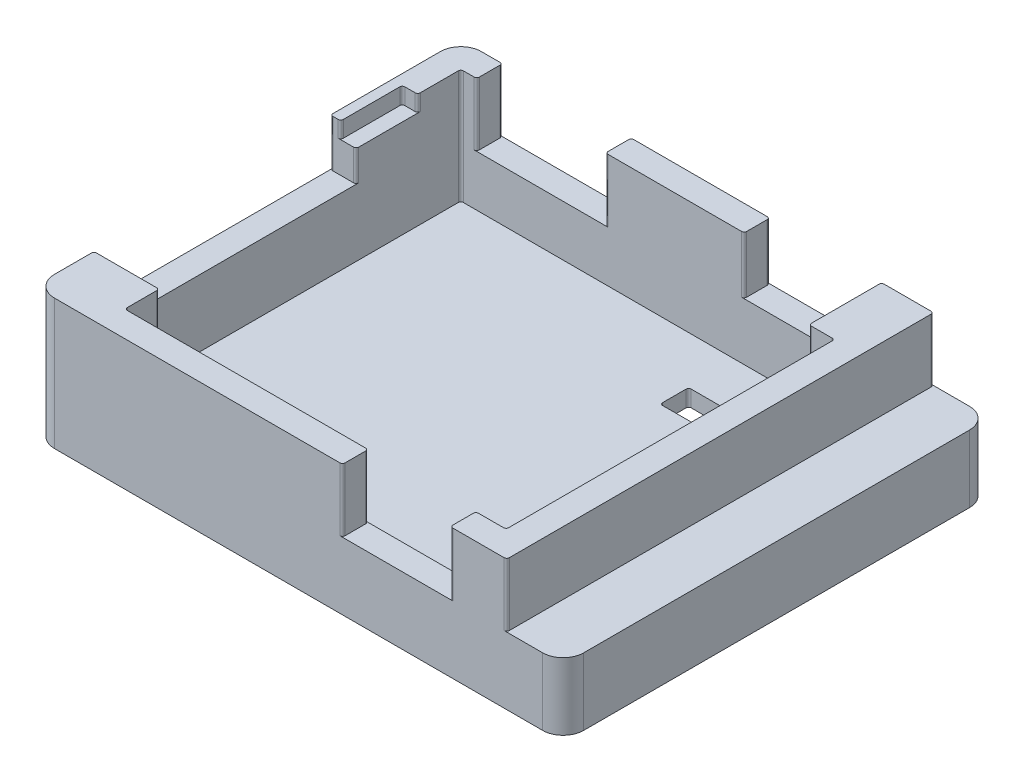
from build123d import *

# Parameters (mm, degrees)
SKETCH1_W           = 103.124
SKETCH1_H           = 83.185
BOSS_EXTRUDE1_DEPTH = 25.4
CUT_EXTRUDE1_DEPTH  = 22.225
SKETCH3_W           = 11
SKETCH3_H           = 83.185
CUT_EXTRUDE2_DEPTH  = 12.3
CUT_EXTRUDE3_REACH  = 136.905
SKETCH4_W           = 21.8
SKETCH4_H           = 11.1
SKETCH4_W_2         = 25.1
SKETCH4_H_2         = 12.3
SKETCH6_W           = 46.085
SKETCH6_H           = 9.2
CUT_EXTRUDE5_DEPTH  = 5.08
SKETCH7_W           = 3
SKETCH7_H           = 12
CUT_EXTRUDE6_DEPTH  = 3.175
SKETCH8_W           = 11.1125
SKETCH8_H           = 5.55625
CUT_EXTRUDE7_DEPTH  = 5.08
FILLET1_R           = 4
CUT_EXTRUDE8_REACH  = 136.905
SKETCH9_W           = 21
SKETCH9_H           = 12.3
FILLET2_R           = 0.5


with BuildPart() as part:
    # Sketch1 → Boss-Extrude1 (new body)
    with BuildSketch(Plane(origin=(0, 0, 0), x_dir=(1, 0, 0), z_dir=(0, 1, 0))):
        with Locations((51.562, 41.5925)):
            Rectangle(SKETCH1_W, SKETCH1_H)
    extrude(amount=BOSS_EXTRUDE1_DEPTH)

    # Sketch2 → Cut-Extrude1 (cut)
    with BuildSketch(Plane(origin=(0, 25.4, 0), x_dir=(1, 0, 0), z_dir=(0, 1, 0))):
        Polygon((5, 78.185), (82, 78.185), (82, 69.0118), (87, 69.0118), (87, 5), (12.7, 5), (12.7, 11.7), (5, 11.7), align=None)
    extrude(amount=-CUT_EXTRUDE1_DEPTH, mode=Mode.SUBTRACT)

    # Sketch3 → Cut-Extrude2 (cut)
    with BuildSketch(Plane(origin=(0, 25.4, 0), x_dir=(1, 0, 0), z_dir=(0, 1, 0))):
        with Locations((97.624, 41.5925)):
            Rectangle(SKETCH3_W, SKETCH3_H)
    extrude(amount=-CUT_EXTRUDE2_DEPTH, mode=Mode.SUBTRACT)

    # Sketch4 → Cut-Extrude3 (cut, up to next)
    with BuildSketch(Plane(origin=(0, 0, -83.185), x_dir=(-1, 0, 0), z_dir=(0, 0, -1)), mode=Mode.PRIVATE) as cut_extrude3_sk1:
        with Locations((-71.1, 19.85)):
            Rectangle(SKETCH4_W, SKETCH4_H)
    cut_extrude3_tool1 = extrude(cut_extrude3_sk1.sketch, amount=-CUT_EXTRUDE3_REACH, mode=Mode.PRIVATE) & part.part
    # Sketch4 → Cut-Extrude3 (cut, up to next)
    with BuildSketch(Plane(origin=(0, 0, -83.185), x_dir=(-1, 0, 0), z_dir=(0, 0, -1)), mode=Mode.PRIVATE) as cut_extrude3_sk2:
        with Locations((-20.65, 19.25)):
            Rectangle(SKETCH4_W_2, SKETCH4_H_2)
    cut_extrude3_tool2 = extrude(cut_extrude3_sk2.sketch, amount=-CUT_EXTRUDE3_REACH, mode=Mode.PRIVATE) & part.part
    add(cut_extrude3_tool1.solids().sort_by_distance((71.1, 19.85, -83.185))[0], mode=Mode.SUBTRACT)
    add(cut_extrude3_tool2.solids().sort_by_distance((20.65, 19.25, -83.185))[0], mode=Mode.SUBTRACT)

    # Sketch6 → Cut-Extrude5 (cut)
    with BuildSketch(Plane.ZY):
        with Locations((-34.7425, 20.8)):
            Rectangle(SKETCH6_W, SKETCH6_H)
    extrude(amount=-CUT_EXTRUDE5_DEPTH, mode=Mode.SUBTRACT)

    # Sketch7 → Cut-Extrude6 (cut)
    with BuildSketch(Plane(origin=(0, 25.4, 0), x_dir=(1, 0, 0), z_dir=(0, 1, 0))):
        with Locations((3.5, 63.785)):
            Rectangle(SKETCH7_W, SKETCH7_H)
    extrude(amount=-CUT_EXTRUDE6_DEPTH, mode=Mode.SUBTRACT)

    # Sketch8 → Cut-Extrude7 (cut)
    with BuildSketch(Plane.XZ):
        with Locations((64.23025, -66.119375)):
            Rectangle(SKETCH8_W, SKETCH8_H)
    extrude(amount=-CUT_EXTRUDE7_DEPTH, mode=Mode.SUBTRACT)

    # Fillet1
    fillet1_edges = [part.edges().sort_by_distance(p)[0] for p in [
        (103.124, 6.55, -83.185),
        (103.124, 6.55, 0),
        (0, 12.7, -83.185),
        (0, 12.7, 0),
    ]]
    fillet(fillet1_edges, radius=FILLET1_R)

    # Sketch9 → Cut-Extrude8 (cut, up to next)
    with BuildSketch(Plane.XY, mode=Mode.PRIVATE) as cut_extrude8_sk1:
        with Locations((70.624, 19.25)):
            Rectangle(SKETCH9_W, SKETCH9_H)
    cut_extrude8_tool1 = extrude(cut_extrude8_sk1.sketch, amount=-CUT_EXTRUDE8_REACH, mode=Mode.PRIVATE) & part.part
    add(cut_extrude8_tool1.solids().sort_by_distance((70.624, 19.25, 0))[0], mode=Mode.SUBTRACT)

    # Fillet2
    fillet2_edges = [part.edges().sort_by_distance(p)[0] for p in [
        (5, 19.2125, -57.785),
        (5, 23.8125, -69.785),
        (2, 23.8125, -57.785),
        (2, 23.8125, -69.785),
        (58.674, 1.5875, -68.8975),
        (58.674, 1.5875, -63.34125),
        (69.7865, 1.5875, -63.34125),
        (69.7865, 1.5875, -68.8975),
        (81.124, 19.25, 0),
        (60.124, 19.25, 0),
        (81.124, 19.25, -5),
        (60.124, 19.25, -5),
        (5, 14.2875, -78.185),
        (5, 9.6875, -11.7),
        (12.7, 14.2875, -11.7),
        (12.7, 14.2875, -5),
        (87, 14.2875, -5),
        (87, 14.2875, -69.0118),
        (82, 14.2875, -69.0118),
        (82, 8.7375, -78.185),
        (92.124, 19.25, 0),
        (92.124, 19.25, -83.185),
        (60.2, 19.85, -78.185),
        (82, 19.85, -83.185),
        (60.2, 19.85, -83.185),
        (33.2, 19.25, -78.185),
        (8.1, 19.25, -78.185),
        (33.2, 19.25, -83.185),
        (8.1, 19.25, -83.185),
        (0, 20.8, -11.7),
        (0, 20.8, -57.785),
    ]]
    fillet(fillet2_edges, radius=FILLET2_R)


solid = part.part
